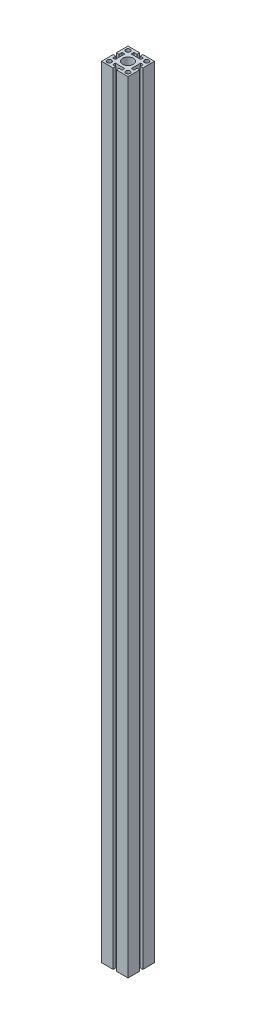
from build123d import *

# Parameters (mm, degrees)
SKETCH1_R           = 10
SKETCH1_R_2         = 4.138691164
BOSS_EXTRUDE1_DEPTH = 1475


with BuildPart() as part:
    # Sketch1 → Boss-Extrude1 (new body)
    with BuildSketch(Plane(origin=(0, 0, 0), x_dir=(1, 0, 0), z_dir=(0, 1, 0))):
        Polygon((-25, -3), (-25, -25), (-3, -25), (-3, -20), (-9, -20), (-9, -15), (9, -15), (9, -20), (3, -20), (3, -25), (25, -25), (25, -3), (20, -3), (20, -9), (15, -9), (15, 9), (20, 9), (20, 3), (25, 3), (25, 25), (3, 25), (3, 20), (9, 20), (9, 15), (-9, 15), (-9, 20), (-3, 20), (-3, 25), (-25, 25), (-25, 3), (-20, 3), (-20, 9), (-15, 9), (-15, -9), (-20, -9), (-20, -3), align=None)
        with Locations(Location((0, 0, 0), (0, 0, 270))):
            Circle(SKETCH1_R, mode=Mode.SUBTRACT)
        with Locations(Location((-17.67766953, 17.67766953, 0), (0, 0, 270))):
            Circle(SKETCH1_R_2, mode=Mode.SUBTRACT)
        with Locations(Location((17.67766953, 17.67766953, 0), (0, 0, 270))):
            Circle(SKETCH1_R_2, mode=Mode.SUBTRACT)
        with Locations(Location((17.67766953, -17.67766953, 0), (0, 0, 270))):
            Circle(SKETCH1_R_2, mode=Mode.SUBTRACT)
        with Locations(Location((-17.67766953, -17.67766953, 0), (0, 0, 270))):
            Circle(SKETCH1_R_2, mode=Mode.SUBTRACT)
    extrude(amount=BOSS_EXTRUDE1_DEPTH)


solid = part.part
